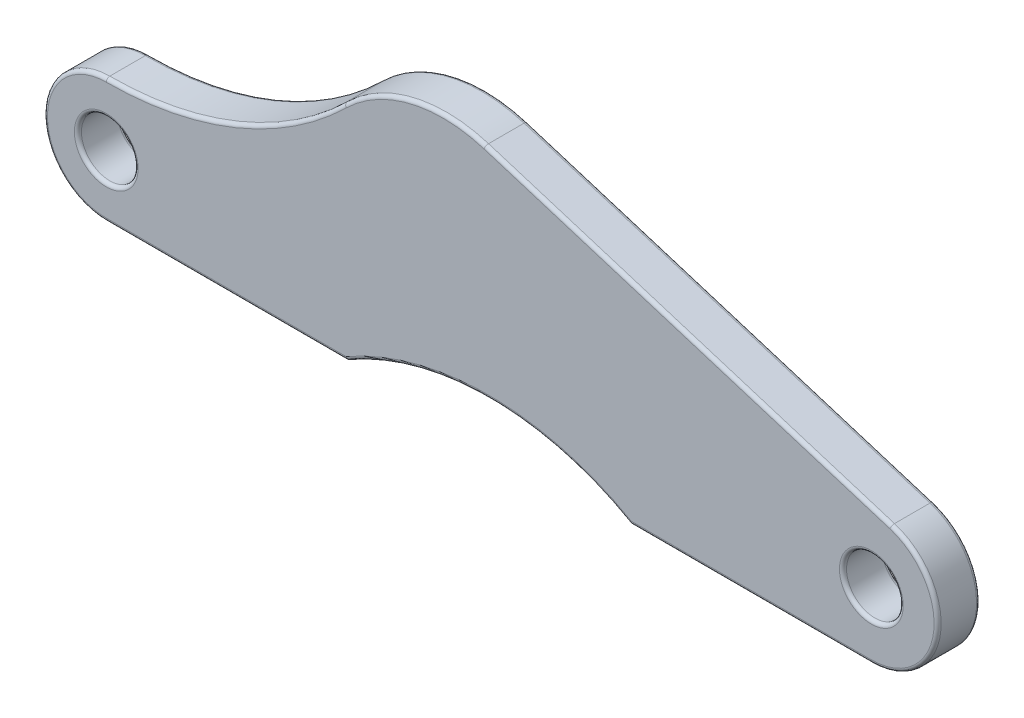
from build123d import *

# Parameters (mm, degrees)
SKETCH1_R           = 2
BOSS_EXTRUDE1_DEPTH = 1.5
FILLET1_R           = 0.25


with BuildPart() as part:
    # Sketch1 → Boss-Extrude1 (new, symmetric)
    with BuildSketch(Plane.XY):
        with BuildLine():
            Line((-27, 0), (-10, 0))
            ThreePointArc((-10, 0), (0, 2.679491924), (10, 0))
            Line((10, 0), (27, 0))
            ThreePointArc((27, 0), (31.624694854, 3.976110042), (28.387100965, 9.144788729))
            Line((28.387100965, 9.144788729), (-0.263497368, 18.041035978))
            ThreePointArc((-0.263497368, 18.041035978), (-5.572599415, 18.212314535), (-10.22040926, 15.640590494))
            ThreePointArc((-10.22040926, 15.640590494), (-17.939807622, 10.575848406), (-27, 8.8))
            ThreePointArc((-27, 8.8), (-31.4, 4.4), (-27, 0))
        make_face()
        with Locations((27, 4.677593574)):
            Circle(SKETCH1_R, mode=Mode.SUBTRACT)
        with Locations((-27, 4.4)):
            Circle(SKETCH1_R, mode=Mode.SUBTRACT)
    extrude(amount=BOSS_EXTRUDE1_DEPTH, both=True)

    # Fillet1
    fillet1_edges = [part.edges().sort_by_distance(p)[0] for p in [
        (0, 2.679491924, 1.5),
        (-18.5, 0, -1.5),
        (-31.4, 4.4, -1.5),
        (18.5, 0, 1.5),
        (31.624694854, 3.976110042, 1.5),
        (14.061801799, 13.592912353, 1.5),
        (-29, 4.4, -1.5),
        (-29, 4.4, 1.5),
        (-5.572599415, 18.212314535, 1.5),
        (25, 4.677593574, -1.5),
        (25, 4.677593574, 1.5),
        (-17.939807622, 10.575848406, 1.5),
        (-31.4, 4.4, 1.5),
        (-18.5, 0, 1.5),
        (-17.939807622, 10.575848406, -1.5),
        (-5.572599415, 18.212314535, -1.5),
        (14.061801799, 13.592912353, -1.5),
        (31.624694854, 3.976110042, -1.5),
        (18.5, 0, -1.5),
        (0, 2.679491924, -1.5),
    ]]
    fillet(fillet1_edges, radius=FILLET1_R)


solid = part.part
